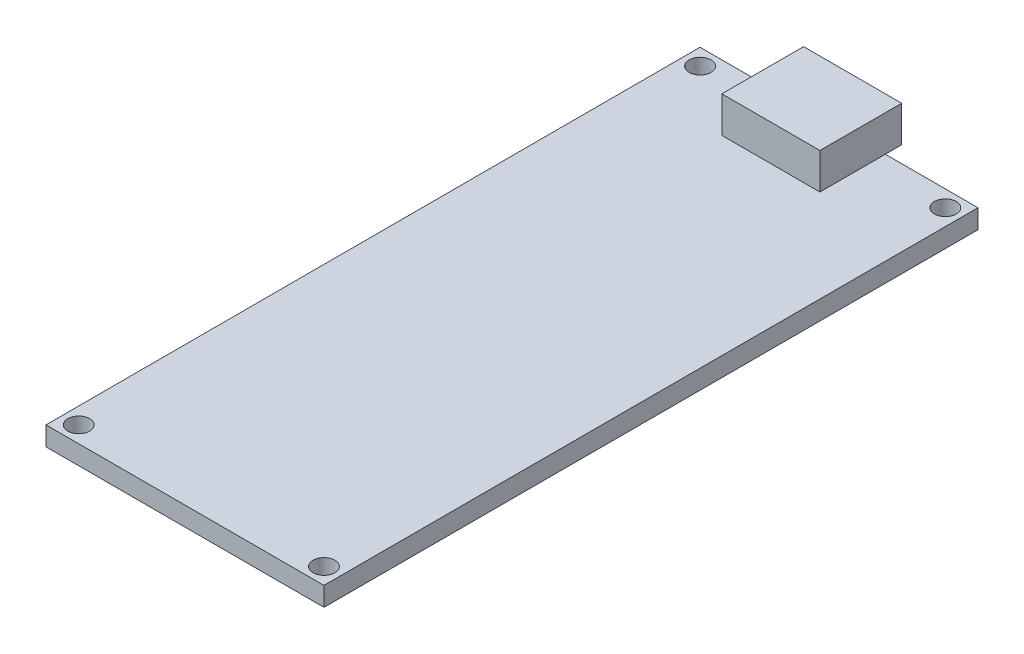
from build123d import *

# Parameters (mm, degrees)
SKETCH1_W           = 25.5
SKETCH1_H           = 60
SKETCH1_R           = 1
BOSS_EXTRUDE1_DEPTH = 1.75
SKETCH2_W           = 9
SKETCH2_H           = 7.5
BOSS_EXTRUDE2_DEPTH = 3.3


with BuildPart() as part:
    # Sketch1 → Boss-Extrude1 (new body)
    with BuildSketch(Plane(origin=(0, 0, 0), x_dir=(1, 0, 0), z_dir=(0, 1, 0))):
        Rectangle(SKETCH1_W, SKETCH1_H)
        with Locations(Location((11.25, 28.5, 0), (0, 0, 270))):
            Circle(SKETCH1_R, mode=Mode.SUBTRACT)
        with Locations(Location((-11.25, 28.5, 0), (0, 0, 90))):
            Circle(SKETCH1_R, mode=Mode.SUBTRACT)
        with Locations(Location((11.25, -28.5, 0), (0, 0, 90))):
            Circle(SKETCH1_R, mode=Mode.SUBTRACT)
        with Locations(Location((-11.25, -28.5, 0), (0, 0, 270))):
            Circle(SKETCH1_R, mode=Mode.SUBTRACT)
    extrude(amount=BOSS_EXTRUDE1_DEPTH)

    # Sketch2 → Boss-Extrude2 (add)
    with BuildSketch(Plane(origin=(0, 1.75, 0), x_dir=(1, 0, 0), z_dir=(0, 1, 0))):
        with Locations((-0.25, 27.75)):
            Rectangle(SKETCH2_W, SKETCH2_H)
    extrude(amount=BOSS_EXTRUDE2_DEPTH)


solid = part.part
